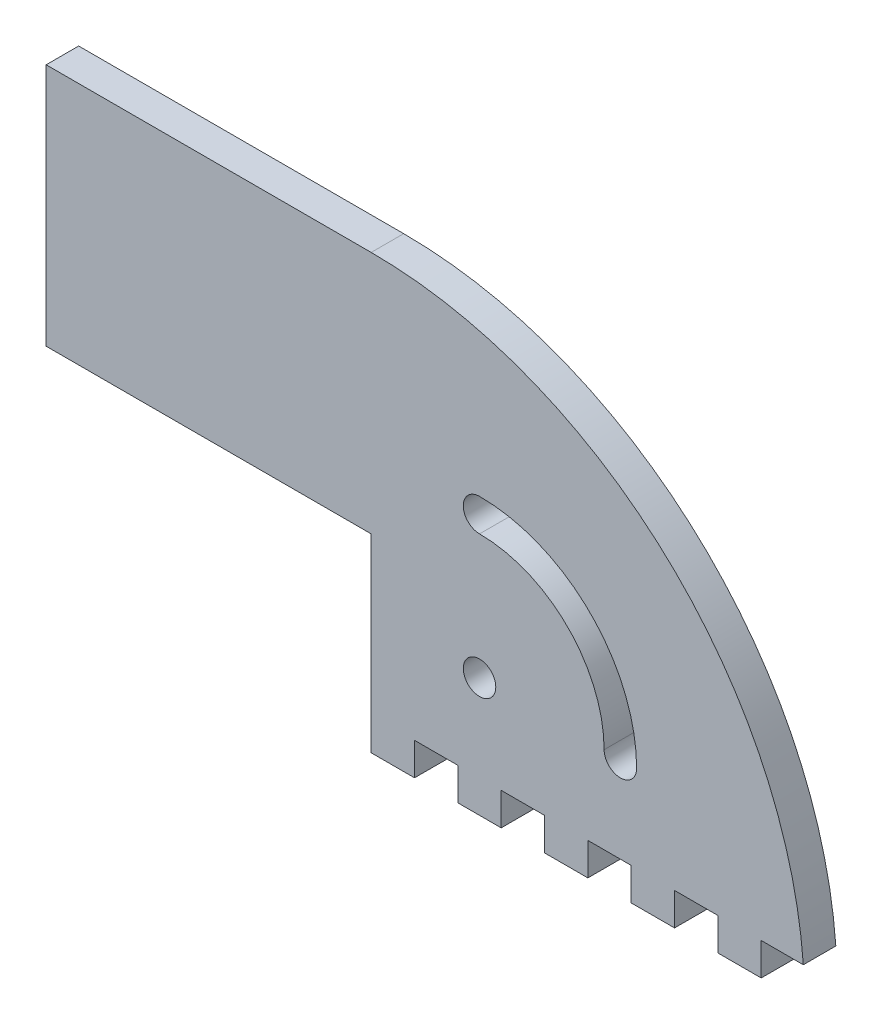
from build123d import *

# Parameters (mm, degrees)
ESQUISSE1_R                = 1.5
BOSS_EXTRU_1_DEPTH         = 3
ESQUISSE2_W                = 4
ESQUISSE2_H                = 3
ENL_V_MAT_EXTRU_2_DEPTH    = 3
R_P_TITION_LIN_AIRE1_COUNT = 5
R_P_TITION_LIN_AIRE1_PITCH = 8


with BuildPart() as part:
    # Esquisse1 → Boss.-Extru.1 (new body)
    with BuildSketch(Plane.XY):
        with BuildLine():
            Line((0, 17.5), (0, 0))
            Line((0, 0), (40, 0))
            ThreePointArc((40, 0), (28.284271247, 28.284271247), (0, 40))
            Line((0, 40), (-30, 40))
            Line((-30, 40), (-30, 17.5))
            Line((-30, 17.5), (0, 17.5))
        make_face()
        with Locations((10, 11)):
            Circle(ESQUISSE1_R, mode=Mode.SUBTRACT)
        with BuildLine():
            ThreePointArc((10, 22.5), (8.5, 24), (10, 25.5))
            ThreePointArc((10, 25.5), (20.253048327, 21.253048327), (24.5, 11))
            ThreePointArc((24.5, 11), (23, 9.5), (21.5, 11))
            ThreePointArc((21.5, 11), (18.131727984, 19.131727984), (10, 22.5))
        make_face(mode=Mode.SUBTRACT)
    extrude(amount=BOSS_EXTRU_1_DEPTH)

    # Esquisse2 → Enlèv. mat.-Extru.2 (cut)
    with BuildSketch(Plane.XY.offset(3)):
        with Locations((6, 1.5)):
            Rectangle(ESQUISSE2_W, ESQUISSE2_H)
    enl_v_mat_extru_2 = extrude(amount=-ENL_V_MAT_EXTRU_2_DEPTH, mode=Mode.SUBTRACT)

    # Répétition linéaire1: Enlèv. mat.-Extru.2 ×5
    with Locations(*[(i * R_P_TITION_LIN_AIRE1_PITCH, 0, 0) for i in range(1, R_P_TITION_LIN_AIRE1_COUNT)]):
        add(enl_v_mat_extru_2, mode=Mode.SUBTRACT)


solid = part.part
